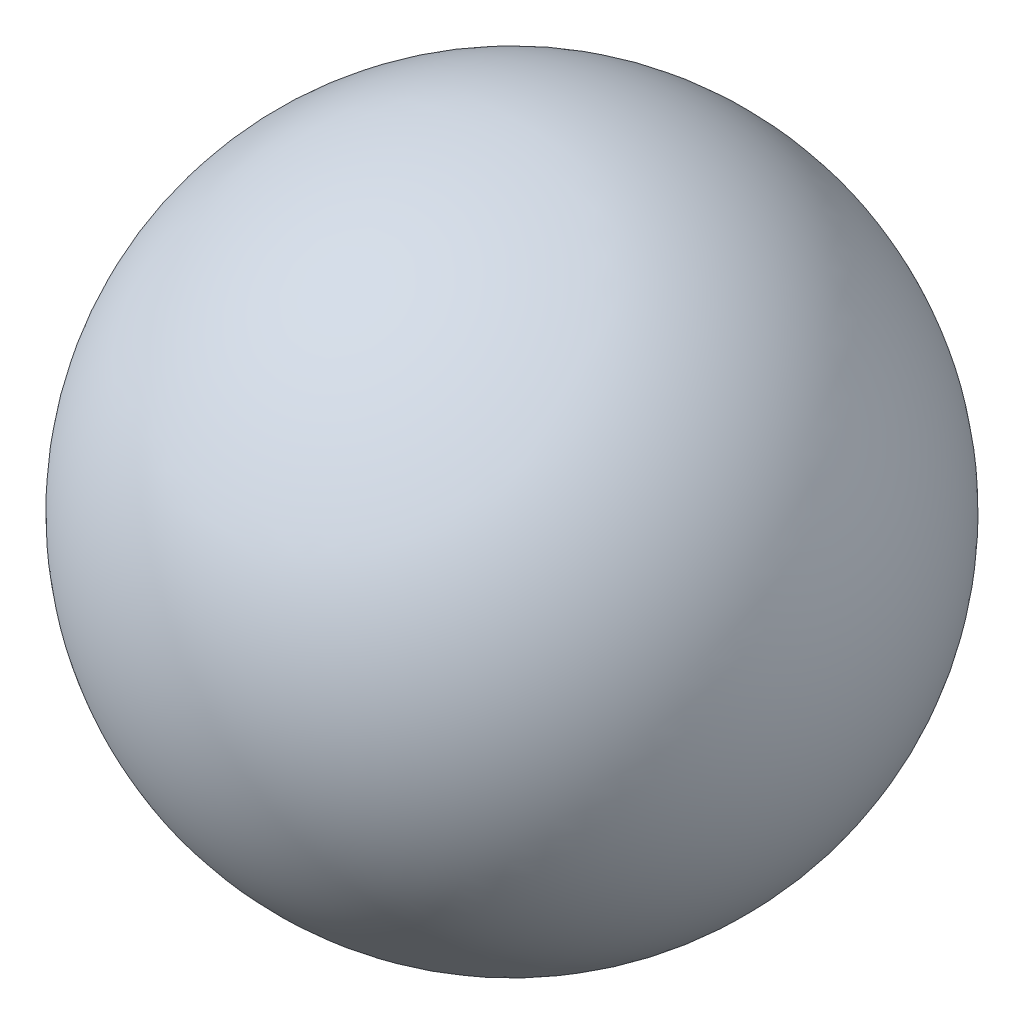
from build123d import *


with BuildPart() as part:
    # Sketch1 → Revolve-Thin1 (revolve)
    with BuildSketch(Plane(origin=(0, 0, 0), x_dir=(1, 0, 0), z_dir=(0, 1, 0))):
        with BuildLine():
            ThreePointArc((0, 2.2), (-2.2, 0), (0, -2.2))
            Line((0, -2.2), (0, -2.25))
            ThreePointArc((0, -2.25), (-2.25, 0), (0, 2.25))
            Line((0, 2.25), (0, 2.2))
        make_face()
    revolve(axis=Axis((0, 0, -2.2), (0, 0, 1)))


solid = part.part
